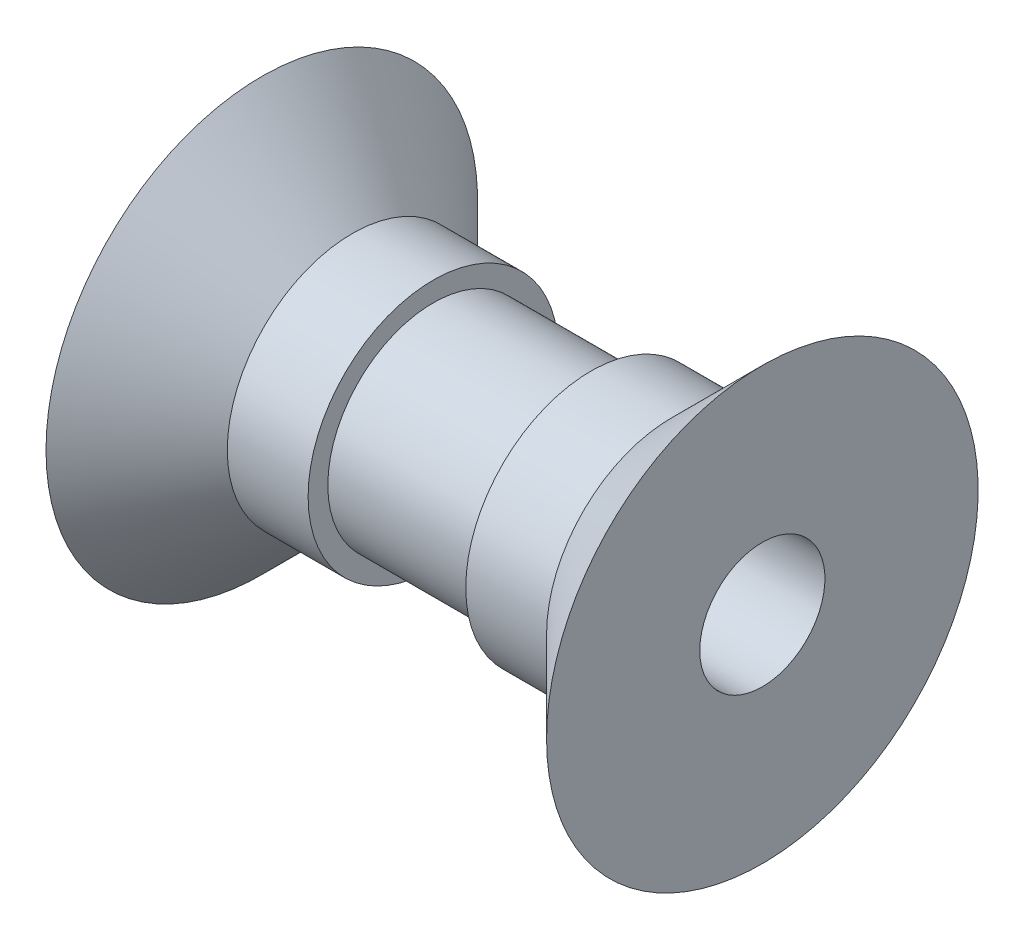
from build123d import *

# Parameters (mm, degrees)
SKETCH2_R          = 1.5875
CUT_EXTRUDE1_DEPTH = 15.87418065


with BuildPart() as part:
    # Sketch1 → Revolve1 (revolve)
    with BuildSketch(Plane.XY, mode=Mode.PRIVATE) as revolve1_sk:
        Polygon((-6.35, 0), (-6.35, 5.475), (-4.05, 3.175), (-2, 3.175), (-2, 2.675), (2, 2.675), (2, 3.175), (4.05, 3.175), (6.35, 5.475), (6.35, 0), align=None)
    revolve(revolve1_sk.sketch.rotate(Axis((-93.951812963, 0, 0), (1, 0, 0)), 90), axis=Axis((-93.951812963, 0, 0), (1, 0, 0)))

    # Sketch2 → Cut-Extrude1 (cut, through all)
    with BuildSketch(Plane.ZY.offset(6.35)):
        Circle(SKETCH2_R)
    extrude(amount=-CUT_EXTRUDE1_DEPTH, mode=Mode.SUBTRACT)


solid = part.part
